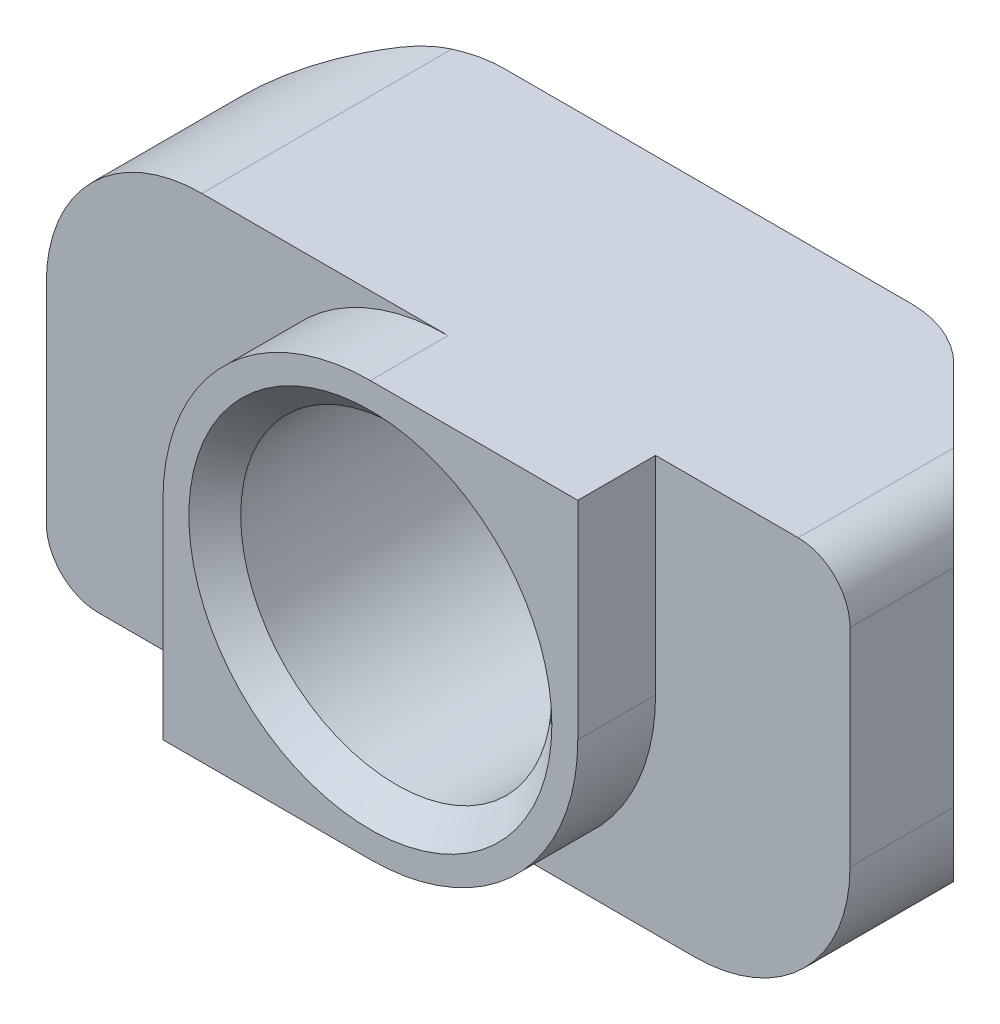
from build123d import *

# Parameters (mm, degrees)
EXTRUDE_1_DEPTH       = 8
SKETCH_2_W            = 3.75
SKETCH_2_H            = 1.5
CUT_EXTRUDE_1_DEPTH   = 13.896220377
SKETCH_3_W            = 3.75
SKETCH_3_H            = 1.5
CUT_EXTRUDE_2_DEPTH   = 13.896220377
HOLE_WIZARD_6_0_6_1_D = 6
CHAMFER_1_SIZE        = 0.5
FILLET_1_R            = 1
FILLET_2_R            = 2
FILLET_3_R            = 3
FILLET_4_R            = 4


with BuildPart() as part:
    # 草图1 → 凸台-拉伸1 (new body)
    with BuildSketch(Plane(origin=(0, 4, 0), x_dir=(1, 0, 0), z_dir=(0, 1, 0))):
        Polygon((-7.75, -3), (-7.75, -6.5), (7.75, -6.5), (7.75, -3), (4.75, 0), (-4.75, 0), align=None)
    extrude(amount=-EXTRUDE_1_DEPTH)

    # 草图2 → 切除-拉伸1 (cut, through all)
    with BuildSketch(Plane.XZ.offset(4)):
        with Locations((-5.875, 5.75)):
            Rectangle(SKETCH_2_W, SKETCH_2_H)
    extrude(amount=-CUT_EXTRUDE_1_DEPTH, mode=Mode.SUBTRACT)

    # 草图3 → 切除-拉伸2 (cut, through all)
    with BuildSketch(Plane.XZ.offset(4)):
        with Locations((5.875, 5.75)):
            Rectangle(SKETCH_3_W, SKETCH_3_H)
    extrude(amount=-CUT_EXTRUDE_2_DEPTH, mode=Mode.SUBTRACT)

    # Ø6.0 (6) 直径孔1 (through all)
    with Locations(Plane(origin=(0, 0, 0), x_dir=(-1, 0, 0), z_dir=(0, 0, -1))):
        with Locations((0, 0)):
            Hole(HOLE_WIZARD_6_0_6_1_D / 2)

    # 倒角1
    chamfer_1_edges = [part.edges().sort_by_distance(p)[0] for p in [
        (-3, 0, 0),
        (-3, 0, 6.5),
    ]]
    chamfer(chamfer_1_edges, length=CHAMFER_1_SIZE)

    # 圆角1
    fillet_1_edges = [part.edges().sort_by_distance(p)[0] for p in [
        (7.75, 4, 4),
        (-7.75, -4, 4),
    ]]
    fillet(fillet_1_edges, radius=FILLET_1_R)

    # 圆角2
    fillet_2_edges = [part.edges().sort_by_distance(p)[0] for p in [
        (-4.75, 0, 0),
        (4.75, 0, 0),
    ]]
    fillet(fillet_2_edges, radius=FILLET_2_R)

    # 圆角3
    fillet_3_edges = [part.edges().sort_by_distance(p)[0] for p in [
        (7.75, -4, 4),
        (-7.75, 4, 4),
    ]]
    fillet(fillet_3_edges, radius=FILLET_3_R)

    # 圆角4
    fillet_4_edges = [part.edges().sort_by_distance(p)[0] for p in [
        (-4, 4, 5.75),
        (4, -4, 5.75),
    ]]
    fillet(fillet_4_edges, radius=FILLET_4_R)


solid = part.part
